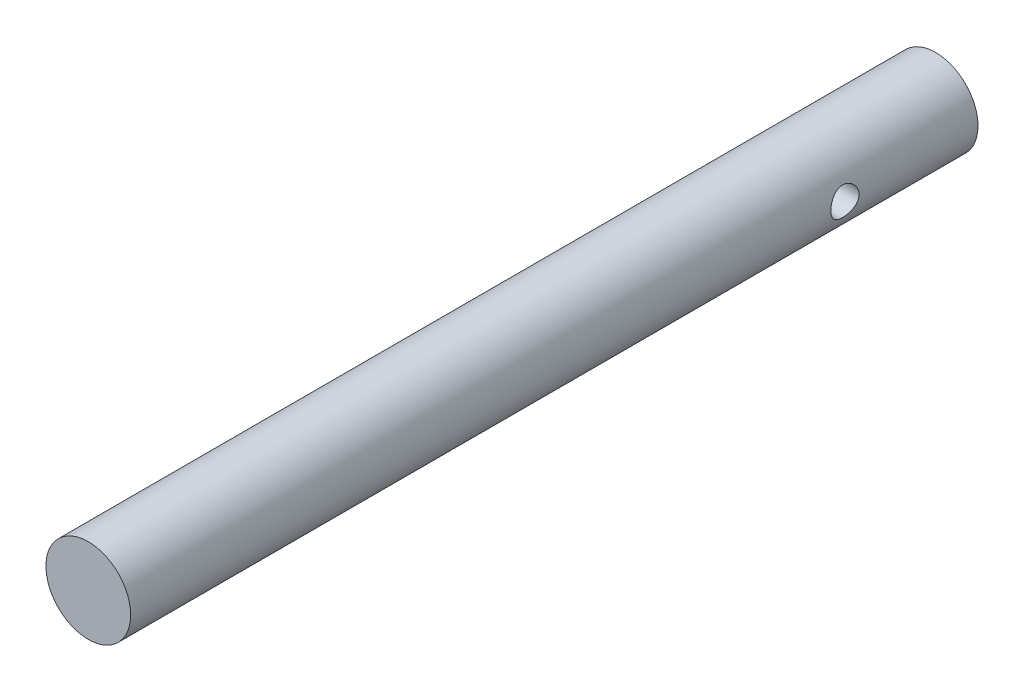
from build123d import *

# Parameters (mm, degrees)
SKETCH1_R               = 3
BOSS_EXTRUDE1_DEPTH     = 60
CUT_EXTRUDE1_DEPTH      = 61.149812967
CUT_EXTRUDE1_DEPTH_BACK = 61.149812967
SKETCH2_R               = 1


with BuildPart() as part:
    # Sketch1 → Boss-Extrude1 (new body)
    with BuildSketch(Plane.XY):
        Circle(SKETCH1_R)
    extrude(amount=BOSS_EXTRUDE1_DEPTH)

    # Sketch2 → Cut-Extrude1 (cut, two sides: drawn at the far end of the back side and taken through both)
    with BuildSketch(Plane(origin=(0, 0, 0), x_dir=(0, 0, -1), z_dir=(1, 0, 0)).offset(-CUT_EXTRUDE1_DEPTH_BACK)):
        with Locations((-9.42, 0)):
            Circle(SKETCH2_R)
    extrude(amount=CUT_EXTRUDE1_DEPTH + CUT_EXTRUDE1_DEPTH_BACK, mode=Mode.SUBTRACT)


solid = part.part
